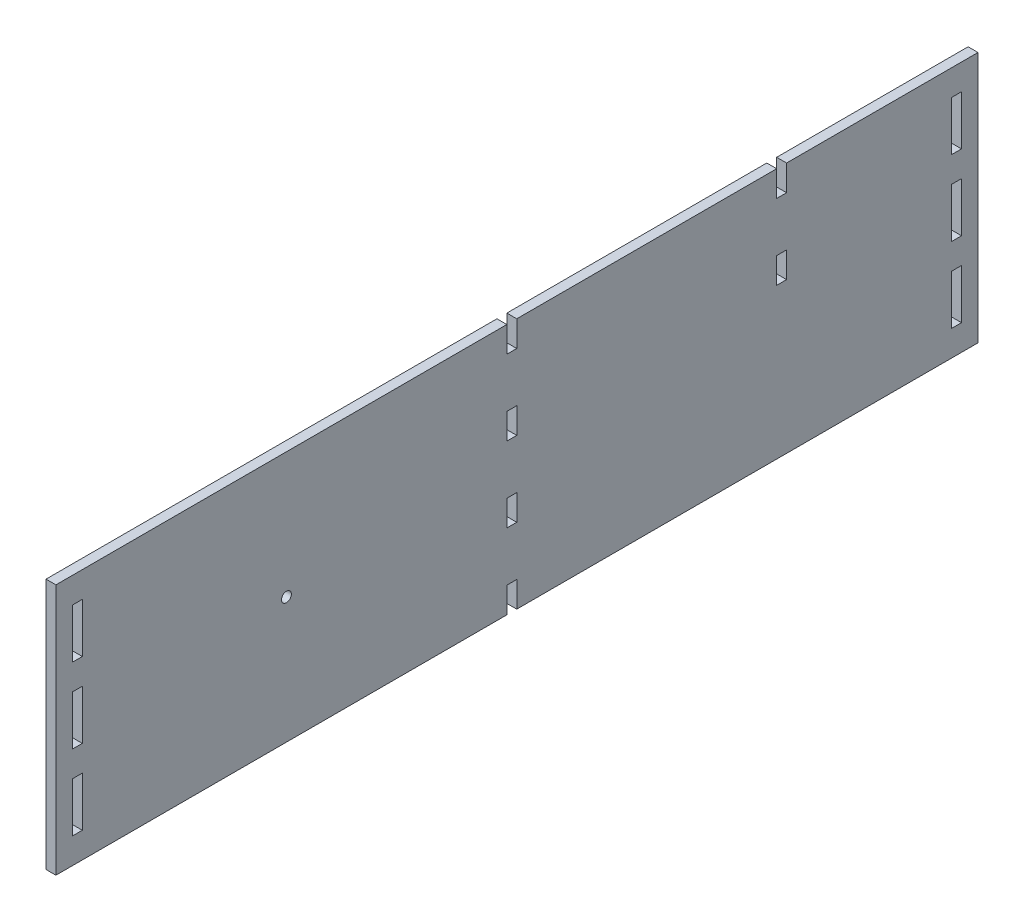
from build123d import *

# Parameters (mm, degrees)
SKETCH1_W                       = 279.4
SKETCH1_H                       = 76.2
BOSS_EXTRUDE1_DEPTH             = 3
SKETCH3_W                       = 3
SKETCH3_H                       = 15
CUT_EXTRUDE1_DEPTH              = 145.833352512
LPATTERN1_COUNT                 = 3
LPATTERN1_PITCH                 = 22.8
MIRROR1_COPY_1_SKETCH_W         = 3
MIRROR1_COPY_1_SKETCH_H         = 15
MIRROR1_COPY_1_DEPTH            = 145.833352512
MIRROR1_COPY_2_SKETCH_W         = 3
MIRROR1_COPY_2_SKETCH_H         = 15
MIRROR1_COPY_2_DEPTH            = 145.833352512
F_3_0MM_CLEARANCE_DOWEL_HOLE1_D = 3
SKETCH6_W                       = 3
SKETCH6_H                       = 7.8
CUT_EXTRUDE2_DEPTH              = 145.833352512
LPATTERN2_COUNT                 = 4
LPATTERN2_PITCH                 = 22.8
SKETCH7_W                       = 3
SKETCH7_H                       = 7.8
CUT_EXTRUDE3_DEPTH              = 10
LPATTERN3_COUNT                 = 2
LPATTERN3_PITCH                 = 22.8


with BuildPart() as part:
    # Sketch1 → Boss-Extrude1 (new body)
    with BuildSketch(Plane(origin=(0, 0, 0), x_dir=(0, 0, -1), z_dir=(1, 0, 0))):
        Rectangle(SKETCH1_W, SKETCH1_H)
    extrude(amount=-BOSS_EXTRUDE1_DEPTH)

    # Sketch3 → Cut-Extrude1 (cut, through all)
    with BuildSketch(Plane.ZY.offset(3)):
        with Locations((133.2, 22.8)):
            Rectangle(SKETCH3_W, SKETCH3_H)
    cut_extrude1 = extrude(amount=-CUT_EXTRUDE1_DEPTH, mode=Mode.SUBTRACT)

    # LPattern1: Cut-Extrude1 ×3
    with Locations(*[(0, -i * LPATTERN1_PITCH, 0) for i in range(1, LPATTERN1_COUNT)]):
        add(cut_extrude1, mode=Mode.SUBTRACT)

    # Mirror1: Cut-Extrude1 across plane
    add(cut_extrude1.mirror(Plane.XY), mode=Mode.SUBTRACT)

    # Mirror1 copy 1 sketch → Mirror1 copy 1 (cut, through all)
    with BuildSketch(Plane(origin=(-3, -22.8, 0), x_dir=(0, 0, -1), z_dir=(-1, 0, 0))):
        with Locations((133.2, -22.8)):
            Rectangle(MIRROR1_COPY_1_SKETCH_W, MIRROR1_COPY_1_SKETCH_H)
    extrude(amount=-MIRROR1_COPY_1_DEPTH, mode=Mode.SUBTRACT)

    # Mirror1 copy 2 sketch → Mirror1 copy 2 (cut, through all)
    with BuildSketch(Plane(origin=(-3, -45.6, 0), x_dir=(0, 0, -1), z_dir=(-1, 0, 0))):
        with Locations((133.2, -22.8)):
            Rectangle(MIRROR1_COPY_2_SKETCH_W, MIRROR1_COPY_2_SKETCH_H)
    extrude(amount=-MIRROR1_COPY_2_DEPTH, mode=Mode.SUBTRACT)

    # Ø3.0mm Clearance Dowel Hole1 (through all)
    with Locations(Plane.ZY.offset(3)):
        with Locations((69.85, 0)):
            Hole(F_3_0MM_CLEARANCE_DOWEL_HOLE1_D / 2)

    # Sketch6 → Cut-Extrude2 (cut, through all)
    with BuildSketch(Plane.ZY.offset(3)):
        with Locations((1.56, 34.2)):
            Rectangle(SKETCH6_W, SKETCH6_H)
    cut_extrude2 = extrude(amount=-CUT_EXTRUDE2_DEPTH, mode=Mode.SUBTRACT)

    # LPattern2: Cut-Extrude2 ×4
    with Locations(*[(0, -i * LPATTERN2_PITCH, 0) for i in range(1, LPATTERN2_COUNT)]):
        add(cut_extrude2, mode=Mode.SUBTRACT)

    # Sketch7 → Cut-Extrude3 (cut)
    with BuildSketch(Plane.ZY.offset(3)):
        with Locations((-80.2, 34.2)):
            Rectangle(SKETCH7_W, SKETCH7_H)
    cut_extrude3 = extrude(amount=-CUT_EXTRUDE3_DEPTH, mode=Mode.SUBTRACT)

    # LPattern3: Cut-Extrude3 ×2
    with Locations(*[(0, -i * LPATTERN3_PITCH, 0) for i in range(1, LPATTERN3_COUNT)]):
        add(cut_extrude3, mode=Mode.SUBTRACT)


solid = part.part
